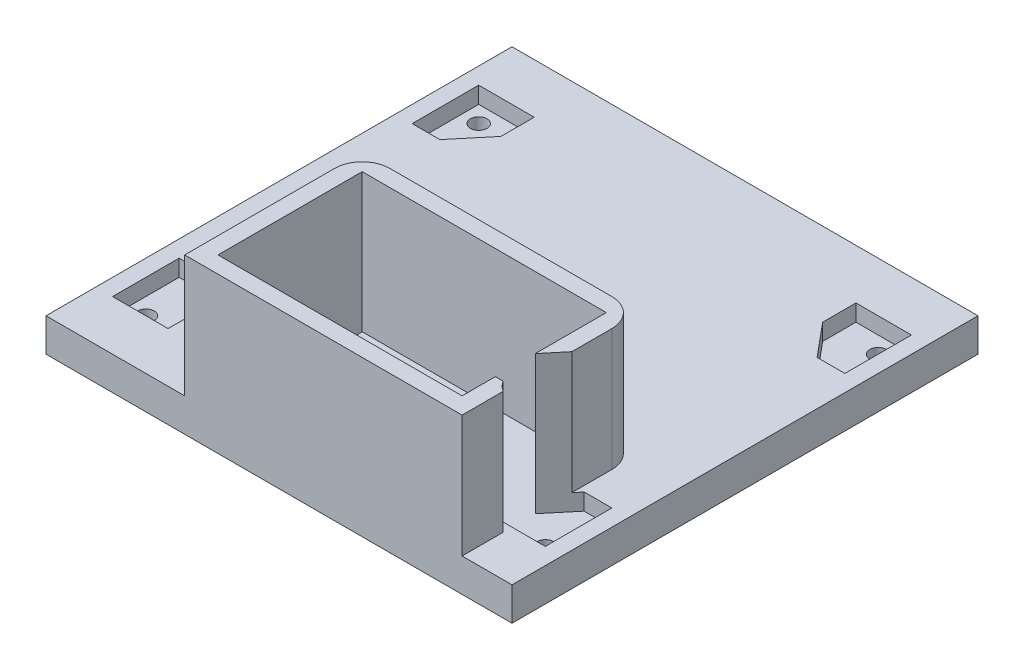
from build123d import *

# Parameters (mm, degrees)
SKETCH1_W               = 84
SKETCH1_H               = 84
BOSS_EXTRUDE1_DEPTH     = 6
SKETCH2_R               = 1.5
CUT_EXTRUDE1_DEPTH      = 119.94536561
SKETCH4_R               = 1.5
CUT_EXTRUDE4_DEPTH      = 3
MIRROR3_COPY_1_SKETCH_R = 1.5
MIRROR3_COPY_1_DEPTH    = 3
SKETCH5_W               = 50
SKETCH5_H               = 32
BOSS_EXTRUDE2_DEPTH     = 22
SKETCH6_W               = 44
SKETCH6_H               = 26
CUT_EXTRUDE5_DEPTH      = 25
SKETCH8_R               = 5.5
CUT_EXTRUDE14_DEPTH     = 22
CUT_EXTRUDE15_DEPTH     = 122.396046064
FILLET2_R               = 5


with BuildPart() as part:
    # Sketch1 → Boss-Extrude1 (new body)
    with BuildSketch(Plane(origin=(0, 0, 0), x_dir=(1, 0, 0), z_dir=(0, 1, 0))):
        with Locations((42, 42)):
            Rectangle(SKETCH1_W, SKETCH1_H)
    extrude(amount=BOSS_EXTRUDE1_DEPTH)

    # Sketch2 → Cut-Extrude1 (cut, through all)
    with BuildSketch(Plane(origin=(0, 6, 0), x_dir=(1, 0, 0), z_dir=(0, 1, 0))):
        with Locations(Location((6, 72, 0), (0, 0, 270))):
            Circle(SKETCH2_R)
        with Locations(Location((6, 12, 0), (0, 0, 270))):
            Circle(SKETCH2_R)
        with Locations(Location((78, 12, 0), (0, 0, 270))):
            Circle(SKETCH2_R)
        with Locations(Location((78, 72, 0), (0, 0, 270))):
            Circle(SKETCH2_R)
    extrude(amount=-CUT_EXTRUDE1_DEPTH, mode=Mode.SUBTRACT)

    # Sketch4 → Cut-Extrude4 (cut)
    with BuildSketch(Plane(origin=(0, 6, 0), x_dir=(1, 0, 0), z_dir=(0, 1, 0))):
        Polygon((13, 15), (13, 9), (3, 9), (3, 21), (8, 21), align=None)
        with Locations(Location((6, 12, 0), (0, 0, 270))):
            Circle(SKETCH4_R, mode=Mode.SUBTRACT)
    cut_extrude4 = extrude(amount=-CUT_EXTRUDE4_DEPTH, mode=Mode.SUBTRACT)

    # Mirror2: Cut-Extrude4 across plane
    add(cut_extrude4.mirror(Plane.XY.offset(-42)), mode=Mode.SUBTRACT)

    # Mirror3: Cut-Extrude4 across plane
    add(cut_extrude4.mirror(Plane.ZY.offset(-42)), mode=Mode.SUBTRACT)

    # Mirror3 copy 1 sketch → Mirror3 copy 1 (cut)
    with BuildSketch(Plane(origin=(84, 6, -84), x_dir=(-1, 0, 0), z_dir=(0, 1, 0))):
        Polygon((13, 15), (13, 9), (3, 9), (3, 21), (8, 21), align=None)
        with Locations(Location((6, 12, 0), (0, 0, 270))):
            Circle(MIRROR3_COPY_1_SKETCH_R, mode=Mode.SUBTRACT)
    extrude(amount=-MIRROR3_COPY_1_DEPTH, mode=Mode.SUBTRACT)

    # Sketch5 → Boss-Extrude2 (add)
    with BuildSketch(Plane(origin=(0, 6, 0), x_dir=(1, 0, 0), z_dir=(0, 1, 0))):
        with Locations((50, 16)):
            Rectangle(SKETCH5_W, SKETCH5_H)
    extrude(amount=BOSS_EXTRUDE2_DEPTH)

    # Sketch6 → Cut-Extrude5 (cut)
    with BuildSketch(Plane(origin=(0, 28, 0), x_dir=(1, 0, 0), z_dir=(0, 1, 0))):
        with Locations((50, 16)):
            Rectangle(SKETCH6_W, SKETCH6_H)
    extrude(amount=-CUT_EXTRUDE5_DEPTH, mode=Mode.SUBTRACT)

    # Sketch8 → Cut-Extrude14 (cut)
    with BuildSketch(Plane(origin=(0, 28, 0), x_dir=(1, 0, 0), z_dir=(0, 1, 0))):
        with Locations((78, 12)):
            Circle(SKETCH8_R)
    extrude(amount=-CUT_EXTRUDE14_DEPTH, mode=Mode.SUBTRACT)

    # Sketch13 → Cut-Extrude15 (cut, through all)
    with BuildSketch(Plane(origin=(0, 3, 0), x_dir=(1, 0, 0), z_dir=(0, 1, 0))):
        Polygon((72, 9), (81, 9), (81, 21), (76, 21), (72, 16.2), (72, 29), (28, 29), (28, 3), (72, 3), align=None)
    extrude(amount=CUT_EXTRUDE15_DEPTH, mode=Mode.SUBTRACT)

    # Fillet2
    fillet2_edges = [part.edges().sort_by_distance(p)[0] for p in [
        (75, 17, -32),
        (25, 17, -32),
    ]]
    fillet(fillet2_edges, radius=FILLET2_R)


solid = part.part
